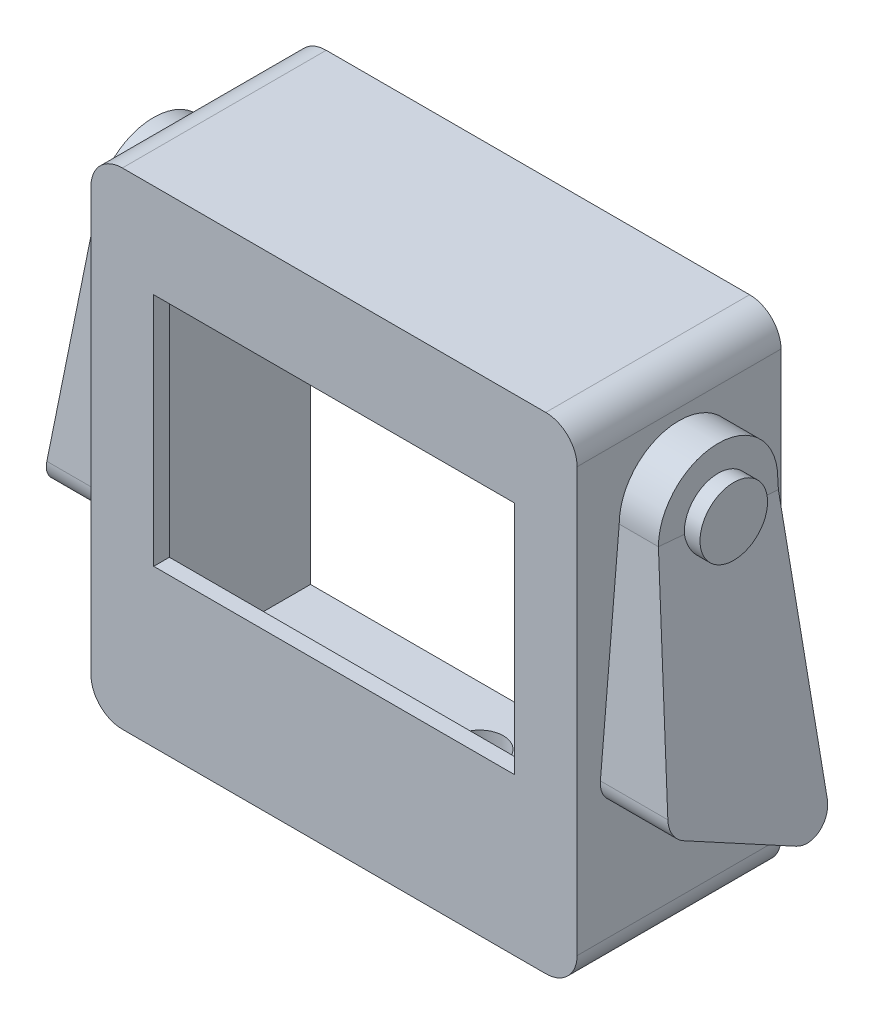
from build123d import *

# Parameters (mm, degrees)
SKETCH_1_W          = 29
SKETCH_1_H          = 29
EXTRUDE_1_DEPTH     = 1
SKETCH_2_W          = 31
SKETCH_2_H          = 31
SKETCH_2_W_2        = 29
SKETCH_2_H_2        = 29
EXTRUDE_2_DEPTH     = 13
EXTRUDE_4_DEPTH     = 5
CUT_EXTRUDE_START   = -14
CUT_EXTRUDE_2_DEPTH = 27
SKETCH_5_R          = 2.15366908
EXTRUDE_5_DEPTH     = 1
FILLET_2_R          = 2
FILLET_3_R          = 1.5
SKETCH_6_R          = 1.5
CUT_EXTRUDE_3_DEPTH = 10


with BuildPart() as part:
    # 草图1 → 凸台-拉伸1 (new body)
    with BuildSketch(Plane.XY):
        Rectangle(SKETCH_1_W, SKETCH_1_H)
        Polygon((-11.5, 0), (-11.5, 9.5), (11.5, 9.5), (11.5, -5.5), (-11.5, -5.5), align=None, mode=Mode.SUBTRACT)
    extrude(amount=EXTRUDE_1_DEPTH)

    # 草图2 → 凸台-拉伸2 (add)
    with BuildSketch(Plane.XY.offset(1)):
        Rectangle(SKETCH_2_W, SKETCH_2_H)
        Rectangle(SKETCH_2_W_2, SKETCH_2_H_2, mode=Mode.SUBTRACT)
    extrude(amount=-EXTRUDE_2_DEPTH)

    # 草图3 → 凸台-拉伸4 (add)
    with BuildSketch(Plane(origin=(15.5, 0, 0), x_dir=(0, 0, -1), z_dir=(1, 0, 0))):
        with BuildLine():
            Line((1.684082639, 8.989995997), (0.397094894, -5.595641246))
            Line((0.397094894, -5.595641246), (10.451208148, -10.79214922))
            Line((10.451208148, -10.79214922), (9.295909354, 8.989995997))
            ThreePointArc((9.295909354, 8.989995997), (5.489995997, 12.795909354), (1.684082639, 8.989995997))
        make_face()
    extrude_4 = extrude(amount=EXTRUDE_4_DEPTH)

    # 草图4 → 切除-拉伸2 (cut)
    with BuildSketch(Plane(origin=(0, -0.077997079, -0.883953322), x_dir=(1, 0, 0), z_dir=(0, 0.08789514896151537, 0.9961297319069606)).offset(CUT_EXTRUDE_START)):
        Polygon((18, 9.103224997), (20.5, -9.831770213), (20.5, 13.243659675), (18, 13.243659675), align=None)
    cut_extrude_2 = extrude(amount=CUT_EXTRUDE_2_DEPTH, mode=Mode.SUBTRACT)

    # 草图5 → 凸台-拉伸5 (add)
    with BuildSketch(Plane(origin=(18, 0, 0), x_dir=(0, 0, -1), z_dir=(1, 0, 0))):
        with Locations(Location((5.489995997, 8.989995997, 0), (0, 0, 183.893189549))):
            Circle(SKETCH_5_R)
    extrude_5 = extrude(amount=EXTRUDE_5_DEPTH)

    # 镜向1: 凸台-拉伸4, 切除-拉伸2, 凸台-拉伸5 across plane
    add(extrude_4.mirror(Plane(origin=(0, 0, 0), x_dir=(0, 0, 1), z_dir=(1, 0, 0))))
    add(cut_extrude_2.mirror(Plane(origin=(0, 0, 0), x_dir=(0, 0, 1), z_dir=(1, 0, 0))), mode=Mode.SUBTRACT)
    add(extrude_5.mirror(Plane(origin=(0, 0, 0), x_dir=(0, 0, 1), z_dir=(1, 0, 0))))

    # 圆角2
    fillet_2_edges = [part.edges().sort_by_distance(p)[0] for p in [
        (15.5, -15.5, -5.5),
        (-15.5, -15.5, -5.5),
        (-15.5, 15.5, -5.5),
        (15.5, 15.5, -5.5),
    ]]
    fillet(fillet_2_edges, radius=FILLET_2_R)

    # 圆角3
    fillet_3_edges = [part.edges().sort_by_distance(p)[0] for p in [
        (-18, -10.79214922, -10.451208148),
        (-17.716616755, -5.595641246, -0.397094894),
        (18, -10.79214922, -10.451208148),
        (17.716616755, -5.595641246, -0.397094894),
    ]]
    fillet(fillet_3_edges, radius=FILLET_3_R)

    # 草图6 → 切除-拉伸3 (cut)
    with BuildSketch(Plane(origin=(0, -14.5, 0), x_dir=(1, 0, 0), z_dir=(0, 1, 0))):
        with Locations(Location((0, 8.292466775, 0), (0, 0, 270))):
            Circle(SKETCH_6_R)
    extrude(amount=-CUT_EXTRUDE_3_DEPTH, mode=Mode.SUBTRACT)


solid = part.part
